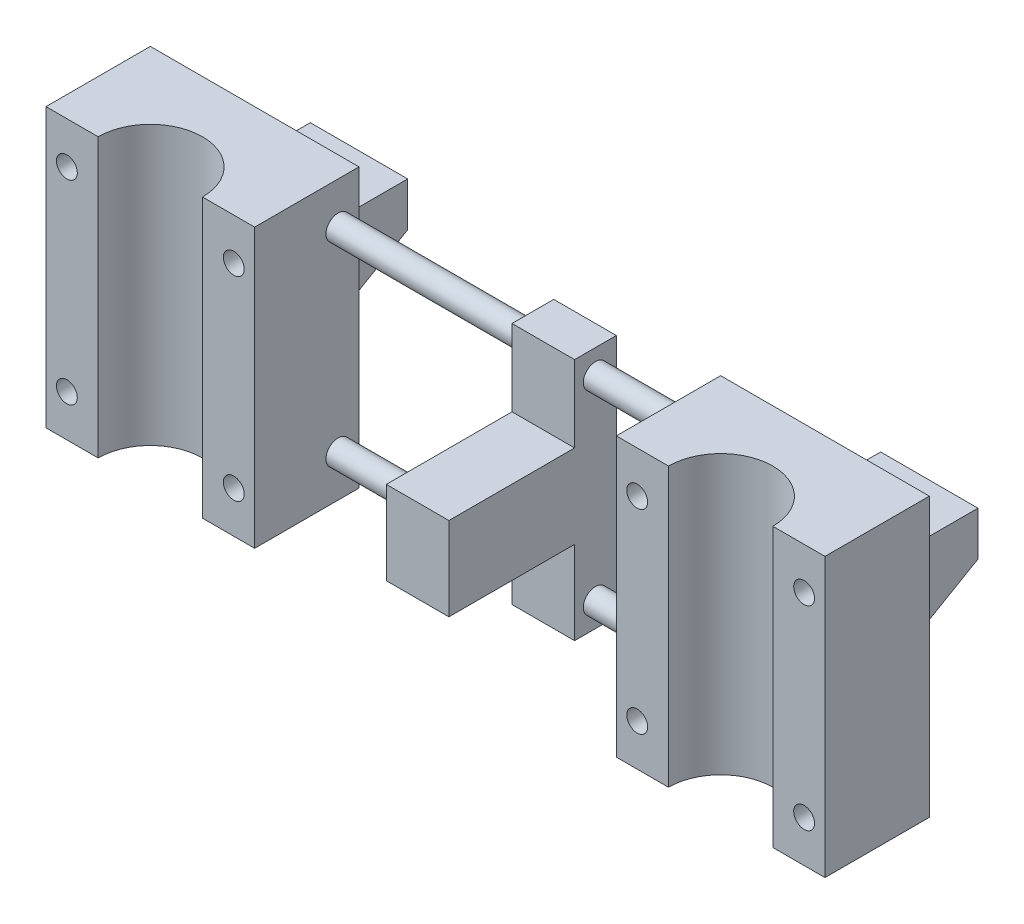
from build123d import *

# Parameters (mm, degrees)
SKETCH1_W            = 30
SKETCH1_H            = 40
BOSS_EXTRUDE1_DEPTH  = 15
CUT_EXTRUDE1_DEPTH   = 49
SKETCH3_R            = 1.5
CUT_EXTRUDE2_DEPTH   = 49
SKETCH4_R            = 1.75
BOSS_EXTRUDE2_DEPTH  = 28
SKETCH5_W            = 6
SKETCH5_H            = 35
BOSS_EXTRUDE3_DEPTH  = 9
SKETCH6_R            = 1.75
BOSS_EXTRUDE4_DEPTH  = 15
SKETCH7_W            = 15
SKETCH7_H            = 40
BOSS_EXTRUDE6_DEPTH  = 30
CUT_EXTRUDE3_DEPTH   = 59
SKETCH10_R           = 1.5
CUT_EXTRUDE4_DEPTH   = 59
SKETCH14_W           = 14
SKETCH14_H           = 15
BOSS_EXTRUDE8_DEPTH  = 15
CUT_EXTRUDE7_DEPTH   = 21
SKETCH17_W           = 9
SKETCH17_H           = 12
BOSS_EXTRUDE10_DEPTH = 18.07


with BuildPart() as part:
    # Sketch1 → Boss-Extrude1 (new body)
    with BuildSketch(Plane.XY):
        with Locations((15, 20)):
            Rectangle(SKETCH1_W, SKETCH1_H)
    extrude(amount=BOSS_EXTRUDE1_DEPTH)

    # Sketch2 → Cut-Extrude1 (cut)
    with BuildSketch(Plane(origin=(0, 40, 0), x_dir=(1, 0, 0), z_dir=(0, 1, 0))):
        with BuildLine():
            Line((7.5, -15), (22.5, -15))
            ThreePointArc((22.5, -15), (15, -7.5), (7.5, -15))
        make_face()
    extrude(amount=-CUT_EXTRUDE1_DEPTH, mode=Mode.SUBTRACT)

    # Sketch3 → Cut-Extrude2 (cut)
    with BuildSketch(Plane.XY.offset(15)):
        with Locations((3, 34)):
            Circle(SKETCH3_R)
        with Locations((3, 6)):
            Circle(SKETCH3_R)
        with Locations((27, 34)):
            Circle(SKETCH3_R)
        with Locations((27, 6)):
            Circle(SKETCH3_R)
    extrude(amount=-CUT_EXTRUDE2_DEPTH, mode=Mode.SUBTRACT)

    # Sketch4 → Boss-Extrude2 (add)
    with BuildSketch(Plane(origin=(30, 0, 0), x_dir=(0, 0, -1), z_dir=(1, 0, 0))):
        with Locations(Location((-3, 34, 0), (0, 0, 180))):
            Circle(SKETCH4_R)
        with Locations(Location((-3, 6, 0), (0, 0, 180))):
            Circle(SKETCH4_R)
    extrude(amount=BOSS_EXTRUDE2_DEPTH)

    # Sketch5 → Boss-Extrude3 (add)
    with BuildSketch(Plane(origin=(58, 0, 0), x_dir=(0, 0, -1), z_dir=(1, 0, 0))):
        with Locations((-3, 20)):
            Rectangle(SKETCH5_W, SKETCH5_H)
    extrude(amount=BOSS_EXTRUDE3_DEPTH)

    # Sketch6 → Boss-Extrude4 (add)
    with BuildSketch(Plane(origin=(67, 0, 0), x_dir=(0, 0, -1), z_dir=(1, 0, 0))):
        with Locations(Location((-3, 34, 0), (0, 0, 180))):
            Circle(SKETCH6_R)
        with Locations(Location((-3, 6, 0), (0, 0, 180))):
            Circle(SKETCH6_R)
    extrude(amount=BOSS_EXTRUDE4_DEPTH)

    # Sketch7 → Boss-Extrude6 (add)
    with BuildSketch(Plane(origin=(82, 0, 0), x_dir=(0, 0, -1), z_dir=(1, 0, 0))):
        with Locations((-7.5, 20)):
            Rectangle(SKETCH7_W, SKETCH7_H)
    extrude(amount=BOSS_EXTRUDE6_DEPTH)

    # Sketch9 → Cut-Extrude3 (cut)
    with BuildSketch(Plane(origin=(0, 40, 0), x_dir=(1, 0, 0), z_dir=(0, 1, 0))):
        with BuildLine():
            Line((89.5, -15), (104.5, -15))
            ThreePointArc((104.5, -15), (97, -7.5), (89.5, -15))
        make_face()
    extrude(amount=-CUT_EXTRUDE3_DEPTH, mode=Mode.SUBTRACT)

    # Sketch10 → Cut-Extrude4 (cut)
    with BuildSketch(Plane.XY.offset(15)):
        with Locations((85, 34)):
            Circle(SKETCH10_R)
        with Locations((109, 34)):
            Circle(SKETCH10_R)
        with Locations((109, 6)):
            Circle(SKETCH10_R)
        with Locations((85, 6)):
            Circle(SKETCH10_R)
    extrude(amount=-CUT_EXTRUDE4_DEPTH, mode=Mode.SUBTRACT)

    # Sketch14 → Boss-Extrude8 (add)
    with BuildSketch(Plane(origin=(0, 0, 0), x_dir=(-1, 0, 0), z_dir=(0, 0, -1))):
        with Locations((-97, 19.5)):
            Rectangle(SKETCH14_W, SKETCH14_H)
    boss_extrude8 = extrude(amount=BOSS_EXTRUDE8_DEPTH)

    # Sketch15 → Cut-Extrude7 (cut)
    with BuildSketch(Plane(origin=(104, 0, 0), x_dir=(0, 0, -1), z_dir=(1, 0, 0))):
        Polygon((0, 12), (15, 20.660254038), (15, 12), align=None)
    cut_extrude7 = extrude(amount=-CUT_EXTRUDE7_DEPTH, mode=Mode.SUBTRACT)

    # Mirror1: Boss-Extrude8, Cut-Extrude7 across plane
    add(boss_extrude8.mirror(Plane(origin=(56, 0, 0), x_dir=(0, 0, 1), z_dir=(1, 0, 0))))
    add(cut_extrude7.mirror(Plane(origin=(56, 0, 0), x_dir=(0, 0, 1), z_dir=(1, 0, 0))), mode=Mode.SUBTRACT)

    # Sketch17 → Boss-Extrude10 (add)
    with BuildSketch(Plane.XY.offset(6)):
        with Locations((62.5, 20.5)):
            Rectangle(SKETCH17_W, SKETCH17_H)
    extrude(amount=BOSS_EXTRUDE10_DEPTH)


solid = part.part
